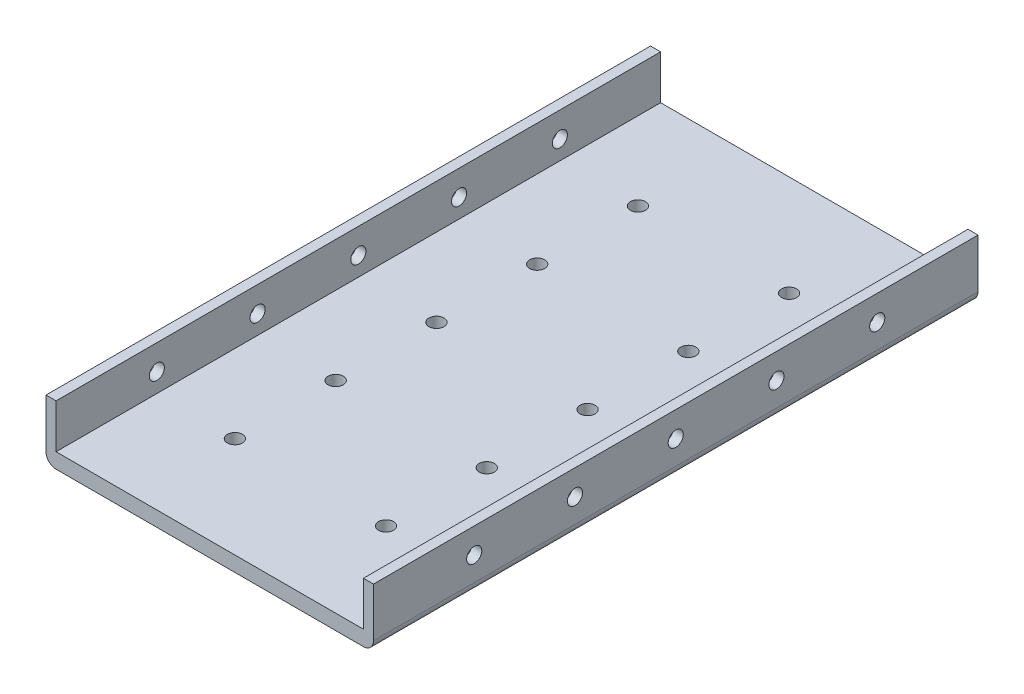
from build123d import *

# Parameters (mm, degrees)
SKETCH_1_W          = 65
SKETCH_1_H          = 120
EXTRUDE_1_DEPTH     = 3
SKETCH_2_W          = 2
SKETCH_2_H          = 120
EXTRUDE_2_DEPTH     = 8.75
FILLET_1_R          = 2
SKETCH_3_R          = 1.5
CUT_EXTRUDE_1_DEPTH = 70.240974141
SKETCH_4_R          = 1.5
CUT_EXTRUDE_2_DEPTH = 90.235993299


with BuildPart() as part:
    # 草图1 → 凸台-拉伸1 (new body)
    with BuildSketch(Plane(origin=(0, 0, 0), x_dir=(1, 0, 0), z_dir=(0, 1, 0))):
        Rectangle(SKETCH_1_W, SKETCH_1_H)
    extrude(amount=EXTRUDE_1_DEPTH)

    # 草图2 → 凸台-拉伸2 (add)
    with BuildSketch(Plane(origin=(0, 3, 0), x_dir=(1, 0, 0), z_dir=(0, 1, 0))):
        with Locations((-31.5, 0)):
            Rectangle(SKETCH_2_W, SKETCH_2_H)
        with Locations((31.5, 0)):
            Rectangle(SKETCH_2_W, SKETCH_2_H)
    extrude(amount=EXTRUDE_2_DEPTH)

    # 圆角1
    fillet_1_edges = [part.edges().sort_by_distance(p)[0] for p in [
        (-32.5, 0, 0),
        (32.5, 0, 0),
    ]]
    fillet(fillet_1_edges, radius=FILLET_1_R)

    # 草图3 → 切除-拉伸1 (cut, through all)
    with BuildSketch(Plane.XZ):
        with Locations(Location((-15, 40, 0), (0, 0, 270))):
            Circle(SKETCH_3_R)
        with Locations(Location((15, 40, 0), (0, 0, 270))):
            Circle(SKETCH_3_R)
        with Locations(Location((-15, 20, 0), (0, 0, 270))):
            Circle(SKETCH_3_R)
        with Locations(Location((15, 20, 0), (0, 0, 270))):
            Circle(SKETCH_3_R)
        with Locations(Location((-15, 0, 0), (0, 0, 270))):
            Circle(SKETCH_3_R)
        with Locations(Location((15, 0, 0), (0, 0, 270))):
            Circle(SKETCH_3_R)
        with Locations(Location((-15, -20, 0), (0, 0, 270))):
            Circle(SKETCH_3_R)
        with Locations(Location((15, -20, 0), (0, 0, 270))):
            Circle(SKETCH_3_R)
        with Locations(Location((-15, -40, 0), (0, 0, 270))):
            Circle(SKETCH_3_R)
        with Locations(Location((15, -40, 0), (0, 0, 270))):
            Circle(SKETCH_3_R)
    extrude(amount=-CUT_EXTRUDE_1_DEPTH, mode=Mode.SUBTRACT)

    # 草图4 → 切除-拉伸2 (cut, through all)
    with BuildSketch(Plane.ZY.offset(32.5)):
        with Locations((0, 6.75)):
            Circle(SKETCH_4_R)
        with Locations((-20, 6.75)):
            Circle(SKETCH_4_R)
        with Locations((-40, 6.75)):
            Circle(SKETCH_4_R)
        with Locations((20, 6.75)):
            Circle(SKETCH_4_R)
        with Locations((40, 6.75)):
            Circle(SKETCH_4_R)
    extrude(amount=-CUT_EXTRUDE_2_DEPTH, mode=Mode.SUBTRACT)


solid = part.part
